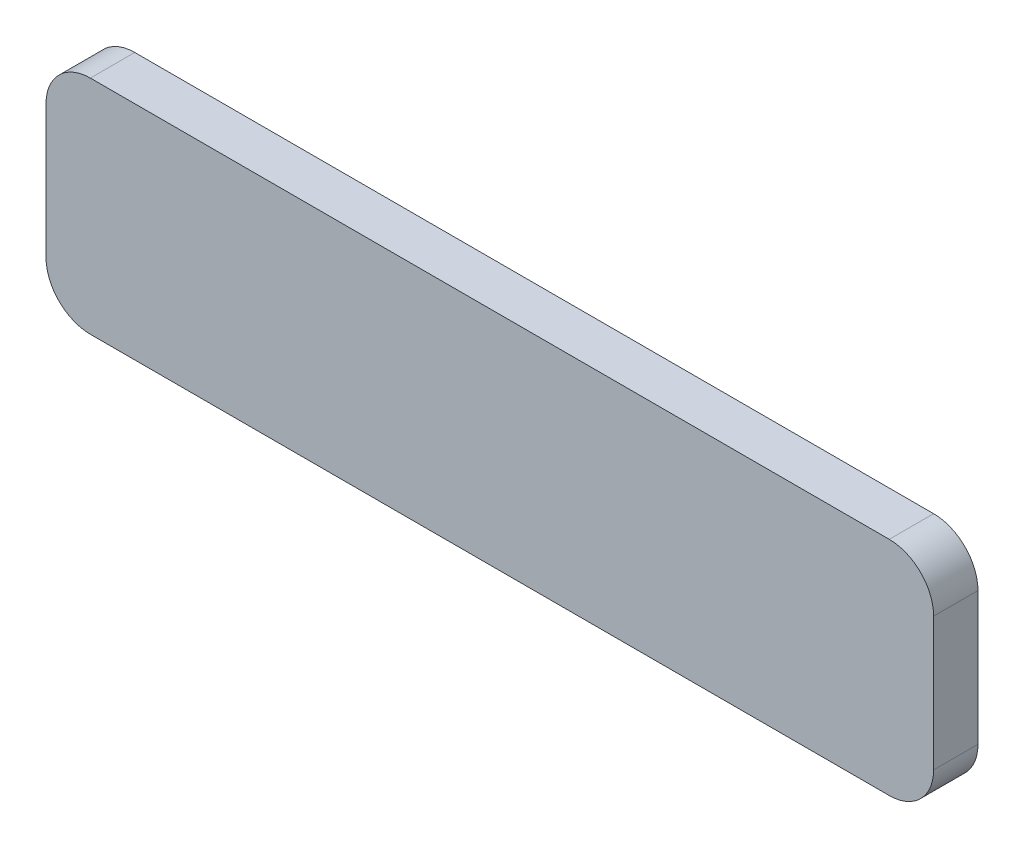
from build123d import *

# Parameters (mm, degrees)
SKETCH1_W           = 20
SKETCH1_H           = 5
BOSS_EXTRUDE1_DEPTH = 1
FILLET1_R           = 1


with BuildPart() as part:
    # Sketch1 → Boss-Extrude1 (new body)
    with BuildSketch(Plane.XY):
        Rectangle(SKETCH1_W, SKETCH1_H)
    extrude(amount=BOSS_EXTRUDE1_DEPTH)

    # Fillet1
    fillet1_edges = [part.edges().sort_by_distance(p)[0] for p in [
        (-10, 2.5, 0.5),
        (10, 2.5, 0.5),
        (10, -2.5, 0.5),
        (-10, -2.5, 0.5),
    ]]
    fillet(fillet1_edges, radius=FILLET1_R)


solid = part.part
